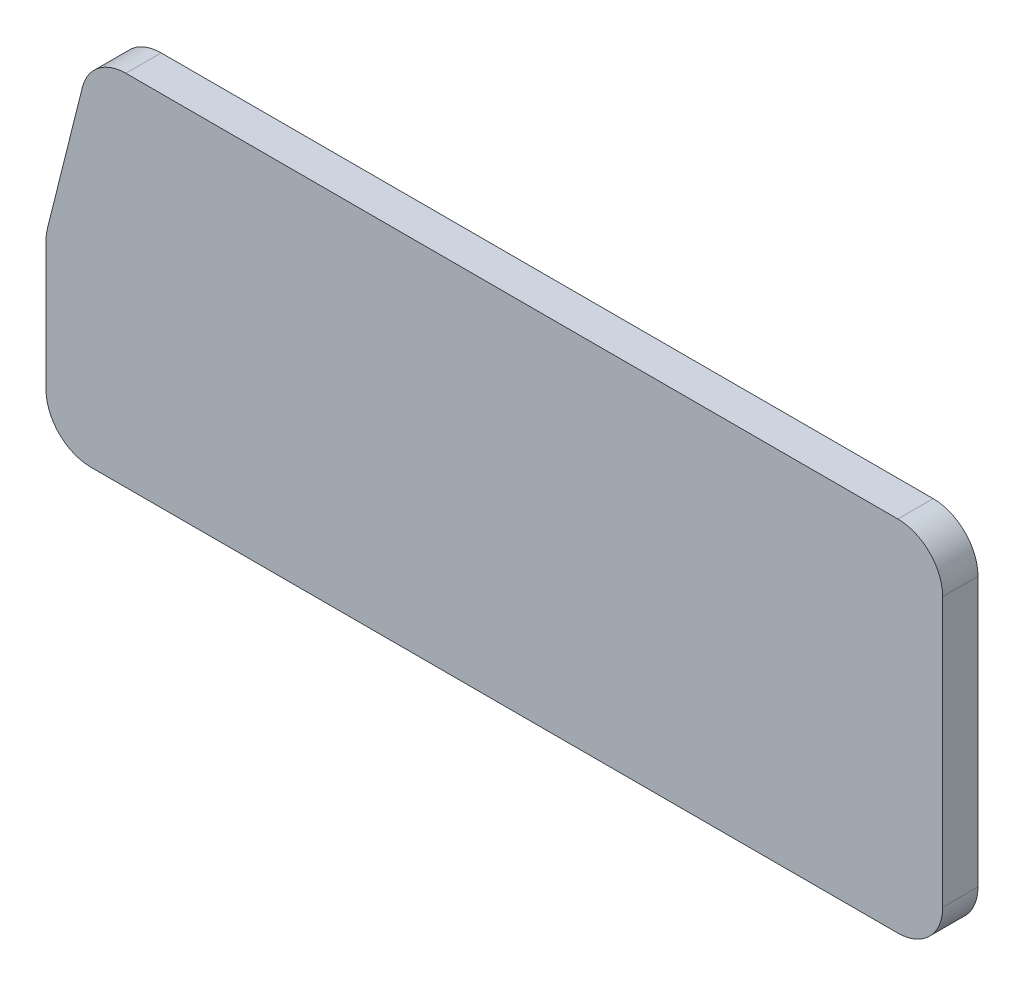
from build123d import *

# Parameters (mm, degrees)
BOSS_EXTRUDE1_DEPTH = 2.5
FILLET1_R           = 6.35


with BuildPart() as part:
    # Sketch1 → Boss-Extrude1 (new, symmetric)
    with BuildSketch(Plane.XY):
        Polygon((-63.5, 0), (-57.15, 25.4), (63.5, 25.4), (63.5, -25.4), (-63.5, -25.4), align=None)
    extrude(amount=BOSS_EXTRUDE1_DEPTH, both=True)

    # Fillet1
    fillet1_edges = [part.edges().sort_by_distance(p)[0] for p in [
        (63.5, -25.4, 0),
        (-63.5, -25.4, 0),
        (-63.5, 0, 0),
        (-57.15, 25.4, 0),
        (63.5, 25.4, 0),
    ]]
    fillet(fillet1_edges, radius=FILLET1_R)


solid = part.part
